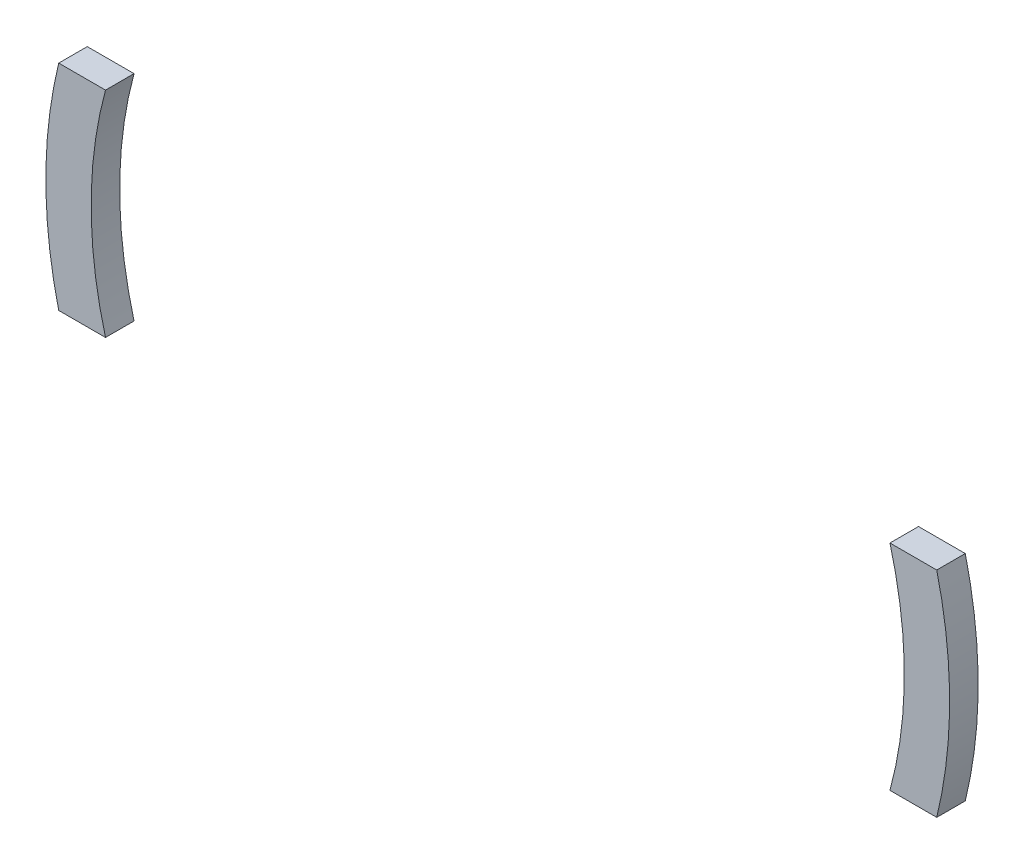
from build123d import *

# Parameters (mm, degrees)
BOSS_EXTRUDE1_DEPTH   = 2.54
BOSS_EXTRUDE1_2_DEPTH = 2.54


with BuildPart() as part:
    # Sketch1 → Boss-Extrude1 (new body)
    with BuildSketch(Plane.XY):
        with BuildLine():
            Line((-39.075700874, 9.53516), (-34.911270727, 9.53516))
            ThreePointArc((-34.911270727, 9.53516), (-36.19, 0), (-34.911270727, -9.53516))
            Line((-34.911270727, -9.53516), (-39.075700874, -9.53516))
            ThreePointArc((-39.075700874, -9.53516), (-40.22225348, 0), (-39.075700874, 9.53516))
        make_face()
    extrude(amount=BOSS_EXTRUDE1_DEPTH)


with BuildPart() as body_2:
    # Sketch1 → Boss-Extrude1 2 (new body)
    with BuildSketch(Plane.XY):
        with BuildLine():
            Line((34.911270727, -9.53516), (39.075700874, -9.53516))
            ThreePointArc((39.075700874, -9.53516), (40.22225348, 0), (39.075700874, 9.53516))
            Line((39.075700874, 9.53516), (34.911270727, 9.53516))
            ThreePointArc((34.911270727, 9.53516), (36.19, 0), (34.911270727, -9.53516))
        make_face()
    extrude(amount=BOSS_EXTRUDE1_2_DEPTH)


solid = Compound([part.part, body_2.part])
